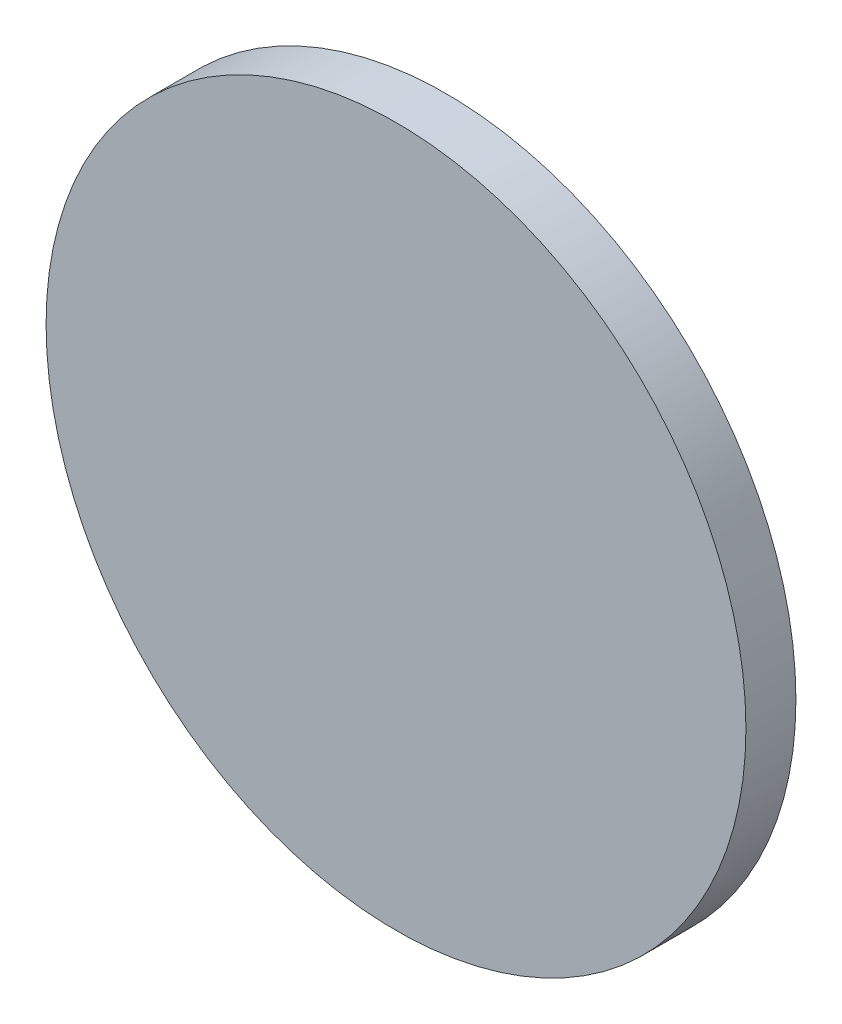
from build123d import *

# Parameters (mm, degrees)
CROQUIS1_R              = 7
SALIENTE_EXTRUIR1_DEPTH = 1
CROQUIS2_R              = 5
CORTAR_EXTRUIR1_DEPTH   = 2
SALIENTE_EXTRUIR3_START = 1
CROQUIS4_R              = 5
SALIENTE_EXTRUIR3_DEPTH = 1


with BuildPart() as part:
    # Croquis1 → Saliente-Extruir1 (new body)
    with BuildSketch(Plane.XY):
        Circle(CROQUIS1_R)
    extrude(amount=SALIENTE_EXTRUIR1_DEPTH)

    # Croquis2 → Cortar-Extruir1 (cut)
    with BuildSketch(Plane.XY.offset(1)):
        Circle(CROQUIS2_R)
    extrude(amount=-CORTAR_EXTRUIR1_DEPTH, mode=Mode.SUBTRACT)

    # Croquis4 → Saliente-Extruir3 (add)
    with BuildSketch(Plane.XY.offset(SALIENTE_EXTRUIR3_START)):
        Circle(CROQUIS4_R)
    extrude(amount=-SALIENTE_EXTRUIR3_DEPTH)


solid = part.part
